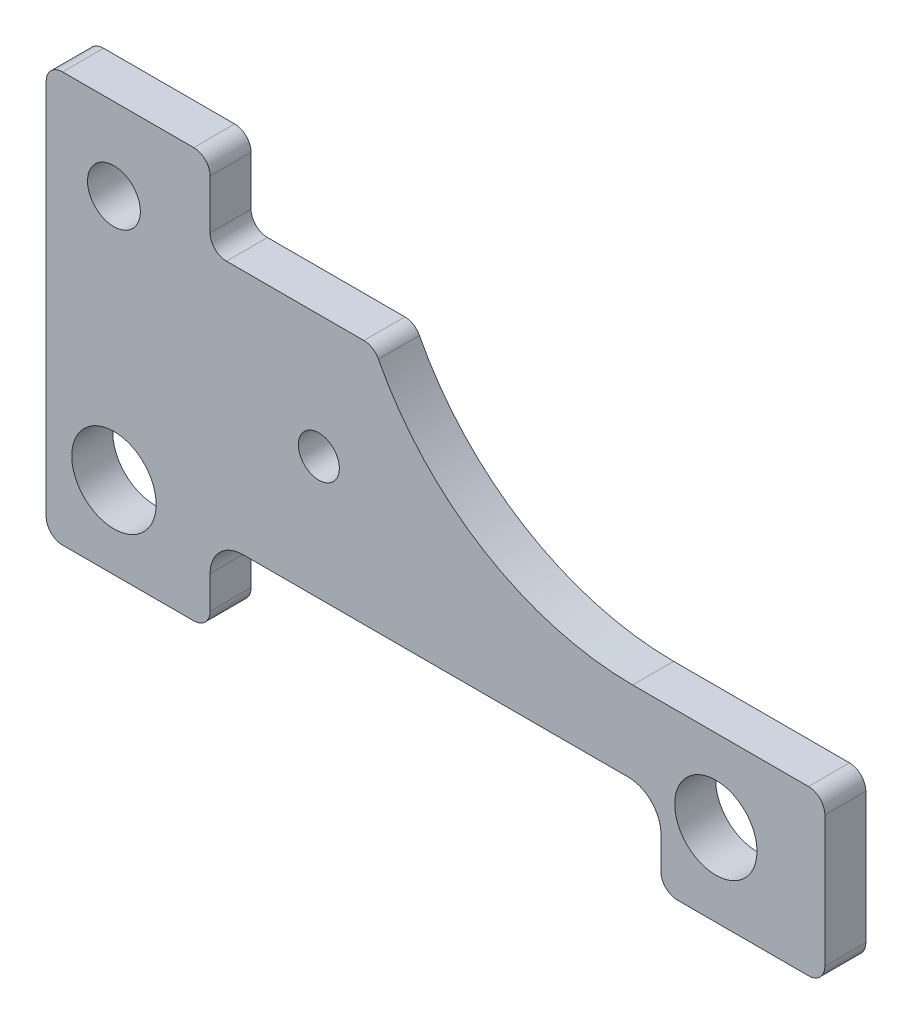
from build123d import *

# Parameters (mm, degrees)
SKETCH1_R           = 5.018077717
SKETCH1_R_2         = 5.15
SKETCH1_R_3         = 3.225
SKETCH1_R_4         = 2.5
BOSS_EXTRUDE1_DEPTH = 5


with BuildPart() as part:
    # Sketch1 → Boss-Extrude1 (new body)
    with BuildSketch(Plane.XY):
        with BuildLine():
            Line((4.242424242, -15), (35.242424242, -15))
            ThreePointArc((35.242424242, -15), (38.070851367, -16.171572875), (39.242424242, -19))
            Line((39.242424242, -19), (39.242424242, -23))
            ThreePointArc((39.242424242, -23), (39.82821068, -24.414213562), (41.242424242, -25))
            Line((41.242424242, -25), (57.242424242, -25))
            ThreePointArc((57.242424242, -25), (58.656637805, -24.414213562), (59.242424242, -23))
            Line((59.242424242, -23), (59.242424242, -7))
            ThreePointArc((59.242424242, -7), (58.656637805, -5.585786438), (57.242424242, -5))
            Line((57.242424242, -5), (35.792732382, -5))
            ThreePointArc((35.792732382, -5), (17.638610474, 0.120331449), (4.778243752, 13.91891486))
            ThreePointArc((4.778243752, 13.91891486), (4.04159661, 14.708483204), (3.001844168, 15))
            Line((3.001844168, 15), (-13.757575758, 15))
            ThreePointArc((-13.757575758, 15), (-15.17178932, 15.585786438), (-15.757575758, 17))
            Line((-15.757575758, 17), (-15.757575758, 23))
            ThreePointArc((-15.757575758, 23), (-16.343362195, 24.414213562), (-17.757575758, 25))
            Line((-17.757575758, 25), (-33.757575758, 25))
            ThreePointArc((-33.757575758, 25), (-35.17178932, 24.414213562), (-35.757575758, 23))
            Line((-35.757575758, 23), (-35.757575758, -23))
            ThreePointArc((-35.757575758, -23), (-35.17178932, -24.414213562), (-33.757575758, -25))
            Line((-33.757575758, -25), (-17.757575758, -25))
            ThreePointArc((-17.757575758, -25), (-16.343362195, -24.414213562), (-15.757575758, -23))
            Line((-15.757575758, -23), (-15.757575758, -19))
            ThreePointArc((-15.757575758, -19), (-14.586002882, -16.171572875), (-11.757575758, -15))
            Line((-11.757575758, -15), (4.242424242, -15))
        make_face()
        with Locations((45.944077131, -15)):
            Circle(SKETCH1_R, mode=Mode.SUBTRACT)
        with Locations((-27.490266303, -15)):
            Circle(SKETCH1_R_2, mode=Mode.SUBTRACT)
        with Locations((-27.490266303, 15)):
            Circle(SKETCH1_R_3, mode=Mode.SUBTRACT)
        with Locations((-2.490266303, 0)):
            Circle(SKETCH1_R_4, mode=Mode.SUBTRACT)
    extrude(amount=BOSS_EXTRUDE1_DEPTH)


solid = part.part
